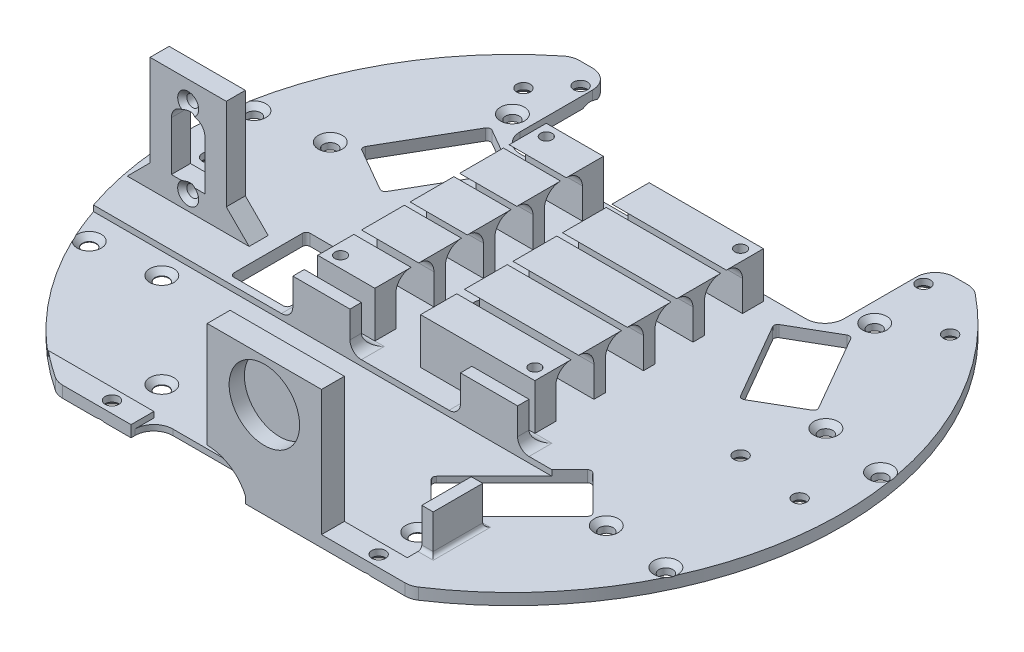
from build123d import *

# Parameters (mm, degrees)
BOSS_EXTRUDE1_DEPTH                                  = 3
CSK_FOR_M3_COUNTERSUNK_FLAT_HEAD_SCR_2_COUNT         = 2
CSK_FOR_M3_COUNTERSUNK_FLAT_HEAD_SCR_2_PITCH         = 53.696889426
CSK_FOR_M3_COUNTERSUNK_FLAT_HEAD_SCR_3_COUNT         = 2
CSK_FOR_M3_COUNTERSUNK_FLAT_HEAD_SCR_3_PITCH         = 87.585955683
CSK_FOR_M3_COUNTERSUNK_FLAT_HEAD_SCR_4_COUNT         = 2
CSK_FOR_M3_COUNTERSUNK_FLAT_HEAD_SCR_4_PITCH         = 17.423625699
CSK_FOR_M3_COUNTERSUNK_FLAT_HEAD_SCR_5_COUNT         = 2
CSK_FOR_M3_COUNTERSUNK_FLAT_HEAD_SCR_5_PITCH         = 47.986357126
CSK_FOR_M3_COUNTERSUNK_FLAT_HEAD_SCR_6_COUNT         = 2
CSK_FOR_M3_COUNTERSUNK_FLAT_HEAD_SCR_6_PITCH         = 133.941650134
CSK_FOR_M3_COUNTERSUNK_FLAT_HEAD_SCR_7_COUNT         = 2
CSK_FOR_M3_COUNTERSUNK_FLAT_HEAD_SCR_7_PITCH         = 147.300574403
CSK_FOR_M3_COUNTERSUNK_FLAT_HEAD_SCR_8_COUNT         = 2
CSK_FOR_M3_COUNTERSUNK_FLAT_HEAD_SCR_8_PITCH         = 136.817828902
CSK_FOR_M3_COUNTERSUNK_FLAT_HEAD_SCR_9_COUNT         = 2
CSK_FOR_M3_COUNTERSUNK_FLAT_HEAD_SCR_9_PITCH         = 148.565381486
CSK_FOR_M3_COUNTERSUNK_FLAT_HEAD_SCR_10_COUNT        = 2
CSK_FOR_M3_COUNTERSUNK_FLAT_HEAD_SCR_10_PITCH        = 165.571291849
CSK_FOR_M3_COUNTERSUNK_FLAT_HEAD_SCR_11_COUNT        = 2
CSK_FOR_M3_COUNTERSUNK_FLAT_HEAD_SCR_11_PITCH        = 164.462894753
CSK_FOR_M3_COUNTERSUNK_FLAT_HEAD_SCR_12_COUNT        = 2
CSK_FOR_M3_COUNTERSUNK_FLAT_HEAD_SCR_12_PITCH        = 50.217868517
CSK_FOR_M3_COUNTERSUNK_FLAT_HEAD_SCR_13_COUNT        = 2
CSK_FOR_M3_COUNTERSUNK_FLAT_HEAD_SCR_13_PITCH        = 55
CSK_FOR_M3_COUNTERSUNK_FLAT_HEAD_SCR_14_COUNT        = 2
CSK_FOR_M3_COUNTERSUNK_FLAT_HEAD_SCR_14_PITCH        = 112
CSK_FOR_M3_COUNTERSUNK_FLAT_HEAD_SCR_15_COUNT        = 2
CSK_FOR_M3_COUNTERSUNK_FLAT_HEAD_SCR_15_PITCH        = 87.458561616
CSK_FOR_M3_COUNTERSUNK_FLAT_HEAD_SCR_16_COUNT        = 2
CSK_FOR_M3_COUNTERSUNK_FLAT_HEAD_SCR_16_PITCH        = 17
CSK_FOR_M3_COUNTERSUNK_FLAT_HEAD_SCR_17_COUNT        = 2
CSK_FOR_M3_COUNTERSUNK_FLAT_HEAD_SCR_17_PITCH        = 105.304320899
CSK_FOR_M3_COUNTERSUNK_FLAT_HEAD_SCR_18_COUNT        = 2
CSK_FOR_M3_COUNTERSUNK_FLAT_HEAD_SCR_18_PITCH        = 59.625917184
CSK_FOR_M3_COUNTERSUNK_FLAT_HEAD_SCR_19_COUNT        = 2
CSK_FOR_M3_COUNTERSUNK_FLAT_HEAD_SCR_19_PITCH        = 148.846397336
CSK_FOR_M3_COUNTERSUNK_FLAT_HEAD_SCR_20_COUNT        = 2
CSK_FOR_M3_COUNTERSUNK_FLAT_HEAD_SCR_20_PITCH        = 157.003184681
CSK_FOR_M3_COUNTERSUNK_FLAT_HEAD_SCR_21_COUNT        = 2
CSK_FOR_M3_COUNTERSUNK_FLAT_HEAD_SCR_21_PITCH        = 127.47548784
CUT_EXTRUDE7_START                                   = -1.5
SKETCH39_W                                           = 79
SKETCH39_H                                           = 39
CUT_EXTRUDE7_DEPTH                                   = 1.5
SKETCH45_W                                           = 85
SKETCH45_H                                           = 29
CUT_EXTRUDE8_DEPTH                                   = 123.366253662
SKETCH48_W                                           = 15
SKETCH48_H                                           = 3
SKETCH48_W_2                                         = 3
SKETCH48_H_2                                         = 13
BOSS_EXTRUDE4_DEPTH                                  = 10
FILLET11_R                                           = 3
CSK_FOR_M3_COUNTERSUNK_FLAT_HEAD_SCR_22_COUNT        = 2
CSK_FOR_M3_COUNTERSUNK_FLAT_HEAD_SCR_22_PITCH        = 17.423625699
CSK_FOR_M3_COUNTERSUNK_FLAT_HEAD_SCR_23_COUNT        = 2
CSK_FOR_M3_COUNTERSUNK_FLAT_HEAD_SCR_23_PITCH        = 35
CSK_FOR_M3_COUNTERSUNK_FLAT_HEAD_SCR_24_COUNT        = 2
CSK_FOR_M3_COUNTERSUNK_FLAT_HEAD_SCR_24_PITCH        = 95.197163823
FILLET14_R                                           = 1
SKETCH52_W                                           = 20
SKETCH52_H                                           = 5
BOSS_EXTRUDE5_DEPTH                                  = 30
CSK_FOR_M2_5_COUNTERSUNK_FLAT_HEAD_SCREW_D           = 3.1
CSK_FOR_M2_5_COUNTERSUNK_FLAT_HEAD_SCREW_CSINK_D     = 5.5
CSK_FOR_M2_5_COUNTERSUNK_FLAT_HEAD_SCREW_CSINK_ANGLE = 90
CUT_EXTRUDE9_REACH                                   = 128.107
CHAMFER1_SIZE                                        = 6
SKETCH56_W                                           = 30
SKETCH56_H                                           = 6
BOSS_EXTRUDE6_DEPTH                                  = 33
SKETCH57_R                                           = 9.25
CUT_EXTRUDE10_DEPTH                                  = 4
CUT_EXTRUDE11_START                                  = -4
CUT_EXTRUDE11_DEPTH                                  = 4
SKETCH60_W                                           = 10
SKETCH60_H                                           = 1.9
CUT_EXTRUDE14_DEPTH                                  = 6
FILLET13_R                                           = 5
SKETCH61_W                                           = 30
SKETCH61_H                                           = 60
SKETCH61_W_2                                         = 15
BOSS_EXTRUDE7_DEPTH                                  = 12
CUT_EXTRUDE15_REACH                                  = 142.482
TAP_DRILL_FOR_M3_TAP1_D                              = 2.5
CUT_EXTRUDE16_REACH                                  = 171.811
CUT_EXTRUDE17_DEPTH                                  = 118.89932153
FILLET15_R                                           = 1
SKETCH67_R                                           = 1.5
CUT_EXTRUDE18_DEPTH                                  = 116.118417368


with BuildPart() as part:
    # Sketch1 → Boss-Extrude1 (new body)
    with BuildSketch(Plane(origin=(0, 0, 0), x_dir=(1, 0, 0), z_dir=(0, 1, 0))):
        with BuildLine():
            Line((-52.657863609, 68.625063935), (52.657863609, 68.625063935))
            ThreePointArc((52.657863609, 68.625063935), (0, -86.5), (-52.657863609, 68.625063935))
        make_face()
        Polygon((34.453193978, 34.325317547), (46.953193978, 12.674682453), (59.943575035, 20.174682453), (47.443575035, 41.825317547), align=None, mode=Mode.SUBTRACT)
        Polygon((43.840620434, -22.627416998), (22.627416998, -43.840620434), (33.234018716, -54.447222151), (54.447222151, -33.234018716), align=None, mode=Mode.SUBTRACT)
        Polygon((-47.443575035, 41.825317547), (-34.453193978, 34.325317547), (-46.953193978, 12.674682453), (-59.943575035, 20.174682453), align=None, mode=Mode.SUBTRACT)
    extrude(amount=BOSS_EXTRUDE1_DEPTH)

    # Sketch43 → CSK for M3 Countersunk Flat Head Screw8 (revolve, cut)
    with BuildSketch(Plane(origin=(82.231447377, 3, -14.499622835), x_dir=(0, 0, 1), z_dir=(1, 0, 0))):
        Polygon((0, 0), (0, 3), (1.8, 3), (1.8, 1.35), (3.15, 0), align=None)
    csk_for_m3_countersunk_flat_head_screw8 = revolve(axis=Axis((82.231447377, 9.35, -14.499622835), (0, -1, 0)), mode=Mode.SUBTRACT)

    # CSK for M3 Countersunk Flat Head Scr 2: CSK for M3 Countersunk Flat Head Screw8 ×2
    with Locations(*[Vector(-0.4450004122078666, 0, 0.8955303641612767) * (i * CSK_FOR_M3_COUNTERSUNK_FLAT_HEAD_SCR_2_PITCH) for i in range(1, CSK_FOR_M3_COUNTERSUNK_FLAT_HEAD_SCR_2_COUNT)]):
        add(csk_for_m3_countersunk_flat_head_screw8, mode=Mode.SUBTRACT)

    # CSK for M3 Countersunk Flat Head Scr 3: CSK for M3 Countersunk Flat Head Screw8 ×2
    with Locations(*[Vector(-0.5553844208357681, 0, 0.8315937380072786) * (i * CSK_FOR_M3_COUNTERSUNK_FLAT_HEAD_SCR_3_PITCH) for i in range(1, CSK_FOR_M3_COUNTERSUNK_FLAT_HEAD_SCR_3_COUNT)]):
        add(csk_for_m3_countersunk_flat_head_screw8, mode=Mode.SUBTRACT)

    # CSK for M3 Countersunk Flat Head Scr 4: CSK for M3 Countersunk Flat Head Screw8 ×2
    with Locations(*[Vector(-0.9865797410635071, 0, -0.16328017186132393) * (i * CSK_FOR_M3_COUNTERSUNK_FLAT_HEAD_SCR_4_PITCH) for i in range(1, CSK_FOR_M3_COUNTERSUNK_FLAT_HEAD_SCR_4_COUNT)]):
        add(csk_for_m3_countersunk_flat_head_screw8, mode=Mode.SUBTRACT)

    # CSK for M3 Countersunk Flat Head Scr 5: CSK for M3 Countersunk Flat Head Screw8 ×2
    with Locations(*[Vector(-0.7229095561335676, 0, -0.6909426703068559) * (i * CSK_FOR_M3_COUNTERSUNK_FLAT_HEAD_SCR_5_PITCH) for i in range(1, CSK_FOR_M3_COUNTERSUNK_FLAT_HEAD_SCR_5_COUNT)]):
        add(csk_for_m3_countersunk_flat_head_screw8, mode=Mode.SUBTRACT)

    # CSK for M3 Countersunk Flat Head Scr 6: CSK for M3 Countersunk Flat Head Screw8 ×2
    with Locations(*[Vector(-0.9688778545897602, 0, -0.24753929563918448) * (i * CSK_FOR_M3_COUNTERSUNK_FLAT_HEAD_SCR_6_PITCH) for i in range(1, CSK_FOR_M3_COUNTERSUNK_FLAT_HEAD_SCR_6_COUNT)]):
        add(csk_for_m3_countersunk_flat_head_screw8, mode=Mode.SUBTRACT)

    # CSK for M3 Countersunk Flat Head Scr 7: CSK for M3 Countersunk Flat Head Screw8 ×2
    with Locations(*[Vector(-0.9998134713302801, 0, -0.019313791613645777) * (i * CSK_FOR_M3_COUNTERSUNK_FLAT_HEAD_SCR_7_PITCH) for i in range(1, CSK_FOR_M3_COUNTERSUNK_FLAT_HEAD_SCR_7_COUNT)]):
        add(csk_for_m3_countersunk_flat_head_screw8, mode=Mode.SUBTRACT)

    # CSK for M3 Countersunk Flat Head Scr 8: CSK for M3 Countersunk Flat Head Screw8 ×2
    with Locations(*[Vector(-0.846519933930845, 0, 0.5323570244278908) * (i * CSK_FOR_M3_COUNTERSUNK_FLAT_HEAD_SCR_8_PITCH) for i in range(1, CSK_FOR_M3_COUNTERSUNK_FLAT_HEAD_SCR_8_COUNT)]):
        add(csk_for_m3_countersunk_flat_head_screw8, mode=Mode.SUBTRACT)

    # CSK for M3 Countersunk Flat Head Scr 9: CSK for M3 Countersunk Flat Head Screw8 ×2
    with Locations(*[Vector(-0.9461676429507629, 0, 0.3236769862579017) * (i * CSK_FOR_M3_COUNTERSUNK_FLAT_HEAD_SCR_9_PITCH) for i in range(1, CSK_FOR_M3_COUNTERSUNK_FLAT_HEAD_SCR_9_COUNT)]):
        add(csk_for_m3_countersunk_flat_head_screw8, mode=Mode.SUBTRACT)

    # CSK for M3 Countersunk Flat Head Scr 10: CSK for M3 Countersunk Flat Head Screw8 ×2
    with Locations(*[Vector(-0.9537169507482278, 0, 0.3007057995042704) * (i * CSK_FOR_M3_COUNTERSUNK_FLAT_HEAD_SCR_10_PITCH) for i in range(1, CSK_FOR_M3_COUNTERSUNK_FLAT_HEAD_SCR_10_COUNT)]):
        add(csk_for_m3_countersunk_flat_head_screw8, mode=Mode.SUBTRACT)

    # CSK for M3 Countersunk Flat Head Scr 11: CSK for M3 Countersunk Flat Head Screw8 ×2
    with Locations(*[(-i * CSK_FOR_M3_COUNTERSUNK_FLAT_HEAD_SCR_11_PITCH, 0, 0) for i in range(1, CSK_FOR_M3_COUNTERSUNK_FLAT_HEAD_SCR_11_COUNT)]):
        add(csk_for_m3_countersunk_flat_head_screw8, mode=Mode.SUBTRACT)

    # CSK for M3 Countersunk Flat Head Scr 12: CSK for M3 Countersunk Flat Head Screw8 ×2
    with Locations(*[Vector(-0.1305261922200562, 0, 0.9914448613738098) * (i * CSK_FOR_M3_COUNTERSUNK_FLAT_HEAD_SCR_12_PITCH) for i in range(1, CSK_FOR_M3_COUNTERSUNK_FLAT_HEAD_SCR_12_COUNT)]):
        add(csk_for_m3_countersunk_flat_head_screw8, mode=Mode.SUBTRACT)

    # Sketch47 → CSK for M3 Countersunk Flat Head Screw9 (revolve, cut)
    with BuildSketch(Plane(origin=(60, 0, -55), x_dir=(0, 0, -1), z_dir=(1, 0, 0))):
        Polygon((0, 0), (0, 3), (1.8, 3), (1.8, 1.35), (3.15, 0), align=None)
    csk_for_m3_countersunk_flat_head_screw9 = revolve(axis=Axis((60, -6.35, -55), (0, 1, 0)), mode=Mode.SUBTRACT)

    # CSK for M3 Countersunk Flat Head Scr 13: CSK for M3 Countersunk Flat Head Screw9 ×2
    with Locations(*[(0, 0, i * CSK_FOR_M3_COUNTERSUNK_FLAT_HEAD_SCR_13_PITCH) for i in range(1, CSK_FOR_M3_COUNTERSUNK_FLAT_HEAD_SCR_13_COUNT)]):
        add(csk_for_m3_countersunk_flat_head_screw9, mode=Mode.SUBTRACT)

    # CSK for M3 Countersunk Flat Head Scr 14: CSK for M3 Countersunk Flat Head Screw9 ×2
    with Locations(*[(-i * CSK_FOR_M3_COUNTERSUNK_FLAT_HEAD_SCR_14_PITCH, 0, 0) for i in range(1, CSK_FOR_M3_COUNTERSUNK_FLAT_HEAD_SCR_14_COUNT)]):
        add(csk_for_m3_countersunk_flat_head_screw9, mode=Mode.SUBTRACT)

    # CSK for M3 Countersunk Flat Head Scr 15: CSK for M3 Countersunk Flat Head Screw9 ×2
    with Locations(*[Vector(-0.7775110720239842, 0, 0.6288692494311634) * (i * CSK_FOR_M3_COUNTERSUNK_FLAT_HEAD_SCR_15_PITCH) for i in range(1, CSK_FOR_M3_COUNTERSUNK_FLAT_HEAD_SCR_15_COUNT)]):
        add(csk_for_m3_countersunk_flat_head_screw9, mode=Mode.SUBTRACT)

    # CSK for M3 Countersunk Flat Head Scr 16: CSK for M3 Countersunk Flat Head Screw9 ×2
    with Locations(*[Vector(-0.8823529411764706, 0, -0.47058823529411764) * (i * CSK_FOR_M3_COUNTERSUNK_FLAT_HEAD_SCR_16_PITCH) for i in range(1, CSK_FOR_M3_COUNTERSUNK_FLAT_HEAD_SCR_16_COUNT)]):
        add(csk_for_m3_countersunk_flat_head_screw9, mode=Mode.SUBTRACT)

    # CSK for M3 Countersunk Flat Head Scr 17: CSK for M3 Countersunk Flat Head Screw9 ×2
    with Locations(*[Vector(-0.9971100815578696, 0, -0.07597029192821865) * (i * CSK_FOR_M3_COUNTERSUNK_FLAT_HEAD_SCR_17_PITCH) for i in range(1, CSK_FOR_M3_COUNTERSUNK_FLAT_HEAD_SCR_17_COUNT)]):
        add(csk_for_m3_countersunk_flat_head_screw9, mode=Mode.SUBTRACT)

    # CSK for M3 Countersunk Flat Head Scr 18: CSK for M3 Countersunk Flat Head Screw9 ×2
    with Locations(*[Vector(0.29349653349697596, 0, 0.9559601376758649) * (i * CSK_FOR_M3_COUNTERSUNK_FLAT_HEAD_SCR_18_PITCH) for i in range(1, CSK_FOR_M3_COUNTERSUNK_FLAT_HEAD_SCR_18_COUNT)]):
        add(csk_for_m3_countersunk_flat_head_screw9, mode=Mode.SUBTRACT)

    # CSK for M3 Countersunk Flat Head Scr 19: CSK for M3 Countersunk Flat Head Screw9 ×2
    with Locations(*[Vector(-0.9237710986670535, 0, 0.38294510999288767) * (i * CSK_FOR_M3_COUNTERSUNK_FLAT_HEAD_SCR_19_PITCH) for i in range(1, CSK_FOR_M3_COUNTERSUNK_FLAT_HEAD_SCR_19_COUNT)]):
        add(csk_for_m3_countersunk_flat_head_screw9, mode=Mode.SUBTRACT)

    # CSK for M3 Countersunk Flat Head Scr 20: CSK for M3 Countersunk Flat Head Screw9 ×2
    with Locations(*[Vector(-0.605083267533558, 0, 0.7961621941231025) * (i * CSK_FOR_M3_COUNTERSUNK_FLAT_HEAD_SCR_20_PITCH) for i in range(1, CSK_FOR_M3_COUNTERSUNK_FLAT_HEAD_SCR_20_COUNT)]):
        add(csk_for_m3_countersunk_flat_head_screw9, mode=Mode.SUBTRACT)

    # CSK for M3 Countersunk Flat Head Scr 21: CSK for M3 Countersunk Flat Head Screw9 ×2
    with Locations(*[Vector(-0.1961161351381841, 0, 0.9805806756909201) * (i * CSK_FOR_M3_COUNTERSUNK_FLAT_HEAD_SCR_21_PITCH) for i in range(1, CSK_FOR_M3_COUNTERSUNK_FLAT_HEAD_SCR_21_COUNT)]):
        add(csk_for_m3_countersunk_flat_head_screw9, mode=Mode.SUBTRACT)

    # Sketch39 → Cut-Extrude7 (cut)
    with BuildSketch(Plane(origin=(0, 3, 0), x_dir=(1, 0, 0), z_dir=(0, 1, 0)).offset(CUT_EXTRUDE7_START)):
        with BuildLine():
            Line((-39.5, -67), (-39.5, -28))
            Line((-39.5, -28), (-81.842837194, -28))
            ThreePointArc((-81.842837194, -28), (-71.006763459, -49.399286868), (-54.710602263, -67))
            Line((-54.710602263, -67), (-39.5, -67))
        make_face()
        with Locations((0, -47.5)):
            Rectangle(SKETCH39_W, SKETCH39_H)
    extrude(amount=CUT_EXTRUDE7_DEPTH, mode=Mode.SUBTRACT)

    # Sketch45 → Cut-Extrude8 (cut, through all)
    with BuildSketch(Plane(origin=(0, 3, 0), x_dir=(1, 0, 0), z_dir=(0, 1, 0))):
        with Locations((0, 54.125063935)):
            Rectangle(SKETCH45_W, SKETCH45_H)
    extrude(amount=-CUT_EXTRUDE8_DEPTH, mode=Mode.SUBTRACT)

    # Sketch48 → Boss-Extrude4 (add)
    with BuildSketch(Plane(origin=(0, 3, 0), x_dir=(1, 0, 0), z_dir=(0, 1, 0))):
        with Locations((-22.031962568, -26.5)):
            Rectangle(SKETCH48_W, SKETCH48_H)
        with Locations((21.968037432, -26.5)):
            Rectangle(SKETCH48_W, SKETCH48_H)
        with Locations((41, -56.681240867)):
            Rectangle(SKETCH48_W_2, SKETCH48_H_2)
    extrude(amount=BOSS_EXTRUDE4_DEPTH)

    # Fillet11
    fillet11_edges = [part.edges().sort_by_distance(p)[0] for p in [
        (-29.531962568, 3, 26.5),
        (-14.531962568, 3, 26.5),
        (-22.031962568, 3, 25),
        (29.468037432, 3, 26.5),
        (21.968037432, 3, 25),
        (14.468037432, 3, 26.5),
    ]]
    fillet(fillet11_edges, radius=FILLET11_R)

    # Sketch51 → CSK for M3 Countersunk Flat Head Screw10 (revolve, cut)
    with BuildSketch(Plane(origin=(-58.336309448, 1.5, 33.587572106), x_dir=(0, 0, 1), z_dir=(1, 0, 0))):
        Polygon((0, 0), (0, 1.5), (1.8, 1.5), (1.8, 1.35), (3.15, 0), align=None)
    csk_for_m3_countersunk_flat_head_screw10 = revolve(axis=Axis((-58.336309448, 7.85, 33.587572106), (0, -1, 0)), mode=Mode.SUBTRACT)

    # CSK for M3 Countersunk Flat Head Scr 22: CSK for M3 Countersunk Flat Head Screw10 ×2
    with Locations(*[Vector(-0.9952228697521389, 0, 0.09762909157785545) * (i * CSK_FOR_M3_COUNTERSUNK_FLAT_HEAD_SCR_22_PITCH) for i in range(1, CSK_FOR_M3_COUNTERSUNK_FLAT_HEAD_SCR_22_COUNT)]):
        add(csk_for_m3_countersunk_flat_head_screw10, mode=Mode.SUBTRACT)

    # CSK for M3 Countersunk Flat Head Scr 23: CSK for M3 Countersunk Flat Head Screw10 ×2
    with Locations(*[Vector(0.707106781186539, 0, 0.7071067811865561) * (i * CSK_FOR_M3_COUNTERSUNK_FLAT_HEAD_SCR_23_PITCH) for i in range(1, CSK_FOR_M3_COUNTERSUNK_FLAT_HEAD_SCR_23_COUNT)]):
        add(csk_for_m3_countersunk_flat_head_screw10, mode=Mode.SUBTRACT)

    # CSK for M3 Countersunk Flat Head Scr 24: CSK for M3 Countersunk Flat Head Screw10 ×2
    with Locations(*[Vector(0.9656157585206697, 0, 0.259973473447873) * (i * CSK_FOR_M3_COUNTERSUNK_FLAT_HEAD_SCR_24_PITCH) for i in range(1, CSK_FOR_M3_COUNTERSUNK_FLAT_HEAD_SCR_24_COUNT)]):
        add(csk_for_m3_countersunk_flat_head_screw10, mode=Mode.SUBTRACT)

    # Fillet14
    fillet14_edges = [part.edges().sort_by_distance(p)[0] for p in [
        (41, 3, 63.181240867),
        (42.5, 3, 56.681240867),
        (41, 3, 50.181240867),
    ]]
    fillet(fillet14_edges, radius=FILLET14_R)

    # Sketch52 → Boss-Extrude5 (add)
    with BuildSketch(Plane(origin=(0, 3, 0), x_dir=(1, 0, 0), z_dir=(0, 1, 0))):
        with Locations((-68, -14.5)):
            Rectangle(SKETCH52_W, SKETCH52_H)
    extrude(amount=BOSS_EXTRUDE5_DEPTH)

    # CSK for M2.5 Countersunk Flat Head Screw1 (through all)
    with Locations(Plane.XY.offset(17)):
        with Locations((-68, 7), (-68, 27.5)):
            CounterSinkHole(CSK_FOR_M2_5_COUNTERSUNK_FLAT_HEAD_SCREW_D / 2, CSK_FOR_M2_5_COUNTERSUNK_FLAT_HEAD_SCREW_CSINK_D / 2, counter_sink_angle=CSK_FOR_M2_5_COUNTERSUNK_FLAT_HEAD_SCREW_CSINK_ANGLE)

    # Sketch53 → Cut-Extrude9 (cut, up to next)
    with BuildSketch(Plane.XY.offset(17), mode=Mode.PRIVATE) as cut_extrude9_sk1:
        with BuildLine():
            Line((-72.4, 9.15), (-72.4, 22.1))
            ThreePointArc((-72.4, 22.1), (-71.448097039, 24.398097039), (-69.15, 25.35))
            Line((-69.15, 25.35), (-66.85, 25.35))
            ThreePointArc((-66.85, 25.35), (-64.551902961, 24.398097039), (-63.6, 22.1))
            Line((-63.6, 22.1), (-63.6, 9.15))
            Line((-63.6, 9.15), (-72.4, 9.15))
        make_face()
    cut_extrude9_tool1 = extrude(cut_extrude9_sk1.sketch, amount=-CUT_EXTRUDE9_REACH, mode=Mode.PRIVATE) & part.part
    add(cut_extrude9_tool1.solids().sort_by_distance((-68, 17.0078, 17))[0], mode=Mode.SUBTRACT)

    # Chamfer1
    chamfer1_edges = [part.edges().sort_by_distance(p)[0] for p in [
        (-78, 3, 14.5),
        (-58, 3, 14.5),
    ]]
    chamfer(chamfer1_edges, length=CHAMFER1_SIZE)

    # Sketch56 → Boss-Extrude6 (add)
    with BuildSketch(Plane(origin=(0, 3, 0), x_dir=(1, 0, 0), z_dir=(0, 1, 0))):
        with Locations((8, -70)):
            Rectangle(SKETCH56_W, SKETCH56_H)
    extrude(amount=BOSS_EXTRUDE6_DEPTH)

    # Sketch57 → Cut-Extrude10 (cut)
    with BuildSketch(Plane.XY.offset(73)):
        with Locations((8, 25)):
            Circle(SKETCH57_R)
    extrude(amount=-CUT_EXTRUDE10_DEPTH, mode=Mode.SUBTRACT)

    # Sketch58 → Cut-Extrude11 (cut)
    with BuildSketch(Plane(origin=(0, 3, 0), x_dir=(1, 0, 0), z_dir=(0, 1, 0)).offset(CUT_EXTRUDE11_START)):
        with BuildLine():
            Line((-46.403124895, -73), (-27, -73))
            Line((-27, -73), (-27, -67))
            Line((-27, -67), (-7, -67))
            Line((-7, -67), (-7, -73))
            Line((-7, -73), (46.403124895, -73))
            ThreePointArc((46.403124895, -73), (0, -86.5), (-46.403124895, -73))
        make_face()
    extrude(amount=CUT_EXTRUDE11_DEPTH, mode=Mode.SUBTRACT)

    # Sketch60 → Cut-Extrude14 (cut)
    with BuildSketch(Plane.XY.offset(73)):
        with Locations((-2, 0.95)):
            Rectangle(SKETCH60_W, SKETCH60_H)
    extrude(amount=-CUT_EXTRUDE14_DEPTH, mode=Mode.SUBTRACT)

    # Fillet13
    fillet13_edges = [part.edges().sort_by_distance(p)[0] for p in [
        (-42.5, 1.5, -39.625063935),
        (42.5, 1.5, -68.625063935),
        (42.5, 1.5, -39.625063935),
        (-42.5, 1.5, -68.625063935),
        (-52.657863609, 1.5, -68.625063935),
        (52.657863609, 1.5, -68.625063935),
        (46.403124895, 1.5, 73),
        (-46.403124895, 1.5, 73),
        (-27, 0.75, 67),
        (3, 0.75, 67),
    ]]
    fillet(fillet13_edges, radius=FILLET13_R)

    # Sketch61 → Boss-Extrude7 (add)
    with BuildSketch(Plane(origin=(0, 3, 0), x_dir=(1, 0, 0), z_dir=(0, 1, 0))):
        with Locations((13, 8)):
            Rectangle(SKETCH61_W, SKETCH61_H)
        with Locations((-21.5, 8)):
            Rectangle(SKETCH61_W_2, SKETCH61_H)
    extrude(amount=BOSS_EXTRUDE7_DEPTH)

    # Cut-Extrude15: up to this face of the body (flat: up to its plane)
    cut_extrude15_end = Plane(part.part.faces().sort_by_distance((-29, 9, -8))[0])
    # Sketch62 → Cut-Extrude15 (cut, up to the picked face)
    with BuildSketch(Plane(origin=(28, 0, 0), x_dir=(0, 0, -1), z_dir=(1, 0, 0)), mode=Mode.PRIVATE) as cut_extrude15_sk1:
        with BuildLine():
            Line((-16.5, 3), (-16.5, 11))
            ThreePointArc((-16.5, 11), (-15.328427125, 13.828427125), (-12.5, 15))
            Line((-12.5, 15), (-10.5, 15))
            ThreePointArc((-10.5, 15), (-7.671572875, 13.828427125), (-6.5, 11))
            Line((-6.5, 11), (-6.5, 3))
            Line((-6.5, 3), (-16.5, 3))
        make_face()
    cut_extrude15_tool1 = split(extrude(cut_extrude15_sk1.sketch, amount=-CUT_EXTRUDE15_REACH, mode=Mode.PRIVATE), bisect_by=cut_extrude15_end, keep=Keep.BOTH, mode=Mode.PRIVATE)
    # Sketch62 → Cut-Extrude15 (cut, up to the picked face)
    with BuildSketch(Plane(origin=(28, 0, 0), x_dir=(0, 0, -1), z_dir=(1, 0, 0)), mode=Mode.PRIVATE) as cut_extrude15_sk2:
        with BuildLine():
            Line((13.75, 15), (15.25, 15))
            ThreePointArc((15.25, 15), (18.168154382, 13.842726531), (19.5, 11))
            Line((19.5, 11), (19.5, 3))
            Line((19.5, 3), (9.5, 3))
            Line((9.5, 3), (9.5, 11))
            ThreePointArc((9.5, 11), (10.831845618, 13.842726531), (13.75, 15))
        make_face()
    cut_extrude15_tool2 = split(extrude(cut_extrude15_sk2.sketch, amount=-CUT_EXTRUDE15_REACH, mode=Mode.PRIVATE), bisect_by=cut_extrude15_end, keep=Keep.BOTH, mode=Mode.PRIVATE)
    # Sketch62 → Cut-Extrude15 (cut, up to the picked face)
    with BuildSketch(Plane(origin=(28, 0, 0), x_dir=(0, 0, -1), z_dir=(1, 0, 0)), mode=Mode.PRIVATE) as cut_extrude15_sk3:
        with BuildLine():
            Line((-3.5, 11), (-3.5, 3))
            Line((-3.5, 3), (6.5, 3))
            Line((6.5, 3), (6.5, 11))
            ThreePointArc((6.5, 11), (5.168154382, 13.842726531), (2.25, 15))
            Line((2.25, 15), (0.75, 15))
            ThreePointArc((0.75, 15), (-2.168154382, 13.842726531), (-3.5, 11))
        make_face()
    cut_extrude15_tool3 = split(extrude(cut_extrude15_sk3.sketch, amount=-CUT_EXTRUDE15_REACH, mode=Mode.PRIVATE), bisect_by=cut_extrude15_end, keep=Keep.BOTH, mode=Mode.PRIVATE)
    # Sketch62 → Cut-Extrude15 (cut, up to the picked face)
    with BuildSketch(Plane(origin=(28, 0, 0), x_dir=(0, 0, -1), z_dir=(1, 0, 0)), mode=Mode.PRIVATE) as cut_extrude15_sk4:
        with BuildLine():
            Line((22.5, 3), (32.5, 3))
            Line((32.5, 3), (32.5, 11))
            ThreePointArc((32.5, 11), (31.168154382, 13.842726531), (28.25, 15))
            Line((28.25, 15), (26.75, 15))
            ThreePointArc((26.75, 15), (23.831845618, 13.842726531), (22.5, 11))
            Line((22.5, 11), (22.5, 3))
        make_face()
    cut_extrude15_tool4 = split(extrude(cut_extrude15_sk4.sketch, amount=-CUT_EXTRUDE15_REACH, mode=Mode.PRIVATE), bisect_by=cut_extrude15_end, keep=Keep.BOTH, mode=Mode.PRIVATE)
    add(cut_extrude15_tool1.solids().sort_by(Axis((28, 8.690029, 11.5), (-1, 0, 0)))[0], mode=Mode.SUBTRACT)
    add(cut_extrude15_tool2.solids().sort_by(Axis((28, 8.652366, -14.5), (-1, 0, 0)))[0], mode=Mode.SUBTRACT)
    add(cut_extrude15_tool3.solids().sort_by(Axis((28, 8.652366, -1.5), (-1, 0, 0)))[0], mode=Mode.SUBTRACT)
    add(cut_extrude15_tool4.solids().sort_by(Axis((28, 8.652366, -27.5), (-1, 0, 0)))[0], mode=Mode.SUBTRACT)

    # Tap Drill for M3 Tap1 (through all)
    with Locations(Plane(origin=(0, 15, 0), x_dir=(1, 0, 0), z_dir=(0, 1, 0))):
        with Locations((-26, -19), (-26, 35), (25, 35), (25, -19)):
            Hole(TAP_DRILL_FOR_M3_TAP1_D / 2)

    # Sketch65 → Cut-Extrude16 (cut, up to next)
    with BuildSketch(Plane.XY.offset(73), mode=Mode.PRIVATE) as cut_extrude16_sk1:
        with BuildLine():
            Line((-7, 8.317424305), (-7, 1.9))
            Line((-7, 1.9), (3, 1.9))
            ThreePointArc((3, 1.9), (-1.058970318, 6.575078777), (-7, 8.317424305))
        make_face()
    cut_extrude16_tool1 = extrude(cut_extrude16_sk1.sketch, amount=-CUT_EXTRUDE16_REACH, mode=Mode.PRIVATE) & part.part
    add(cut_extrude16_tool1.solids().sort_by_distance((-3.0441, 4.544403, 73))[0], mode=Mode.SUBTRACT)

    # Sketch66 → Cut-Extrude17 (cut, through all)
    with BuildSketch(Plane(origin=(0, 3, 0), x_dir=(1, 0, 0), z_dir=(0, 1, 0))):
        with BuildLine():
            Line((-47, -6), (-34, -6))
            ThreePointArc((-34, -6), (-33.292893219, -6.292893219), (-33, -7))
            Line((-33, -7), (-33, -25))
            ThreePointArc((-33, -25), (-33.292893219, -25.707106781), (-34, -26))
            Line((-34, -26), (-47, -26))
            ThreePointArc((-47, -26), (-47.707106781, -25.707106781), (-48, -25))
            Line((-48, -25), (-48, -7))
            ThreePointArc((-48, -7), (-47.707106781, -6.292893219), (-47, -6))
        make_face()
    extrude(amount=-CUT_EXTRUDE17_DEPTH, mode=Mode.SUBTRACT)

    # Fillet15
    fillet15_edges = [part.edges().sort_by_distance(p)[0] for p in [
        (46.953193978, 1.5, -12.674682453),
        (59.943575035, 1.5, -20.174682453),
        (47.443575035, 1.5, -41.825317547),
        (34.453193978, 1.5, -34.325317547),
        (54.447222151, 1.5, 33.234018716),
        (43.840620434, 1.5, 22.627416998),
        (22.627416998, 0.75, 43.840620434),
        (33.234018716, 0.75, 54.447222151),
        (-47.443575035, 1.5, -41.825317547),
        (-59.943575035, 1.5, -20.174682453),
        (-46.953193978, 1.5, -12.674682453),
        (-34.453193978, 1.5, -34.325317547),
    ]]
    fillet(fillet15_edges, radius=FILLET15_R)

    # Sketch67 → Cut-Extrude18 (cut, through all)
    with BuildSketch(Plane(origin=(0, 15, 0), x_dir=(1, 0, 0), z_dir=(0, 1, 0))):
        with Locations(Location((-26, -19, 0), (0, 0, 270))):
            Circle(SKETCH67_R)
        with Locations(Location((25, -19, 0), (0, 0, 270))):
            Circle(SKETCH67_R)
        with Locations(Location((25, 35, 0), (0, 0, 270))):
            Circle(SKETCH67_R)
        with Locations(Location((-26, 35, 0), (0, 0, 270))):
            Circle(SKETCH67_R)
    extrude(amount=-CUT_EXTRUDE18_DEPTH, mode=Mode.SUBTRACT)


solid = part.part
